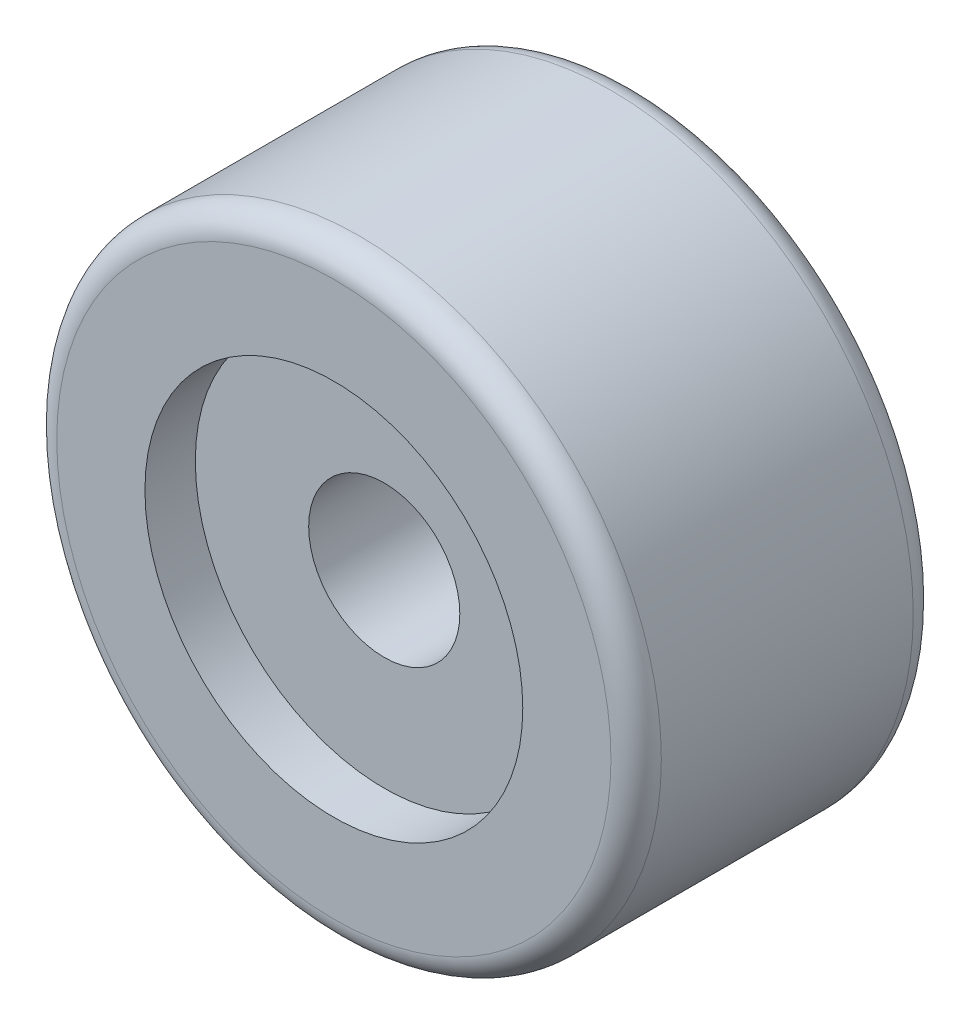
from build123d import *

# Parameters (mm, degrees)
SKETCH_1_R          = 6
SKETCH_1_R_2        = 1.5
EXTRUDE_1_DEPTH     = 6
SKETCH_2_R          = 3.75
CUT_EXTRUDE_1_DEPTH = 1
CUT_EXTRUDE_START   = -1
SKETCH_3_R          = 3.75
CUT_EXTRUDE_2_DEPTH = 1
FILLET_1_R          = 0.5


with BuildPart() as part:
    # 草图1 → 凸台-拉伸1 (new body)
    with BuildSketch(Plane.XY):
        Circle(SKETCH_1_R)
        Circle(SKETCH_1_R_2, mode=Mode.SUBTRACT)
    extrude(amount=EXTRUDE_1_DEPTH)

    # 草图2 → 切除-拉伸1 (cut)
    with BuildSketch(Plane.XY.offset(6)):
        Circle(SKETCH_2_R)
    extrude(amount=-CUT_EXTRUDE_1_DEPTH, mode=Mode.SUBTRACT)

    # 草图3 → 切除-拉伸2 (cut)
    with BuildSketch(Plane(origin=(0, 0, 0), x_dir=(-1, 0, 0), z_dir=(0, 0, -1)).offset(CUT_EXTRUDE_START)):
        with Locations(Location((0, 0, 0), (0, 0, 180))):
            Circle(SKETCH_3_R)
    extrude(amount=CUT_EXTRUDE_2_DEPTH, mode=Mode.SUBTRACT)

    # 圆角1
    fillet_1_edges = [part.edges().sort_by_distance(p)[0] for p in [
        (-6, 0, 0),
        (-6, 0, 6),
    ]]
    fillet(fillet_1_edges, radius=FILLET_1_R)


solid = part.part
